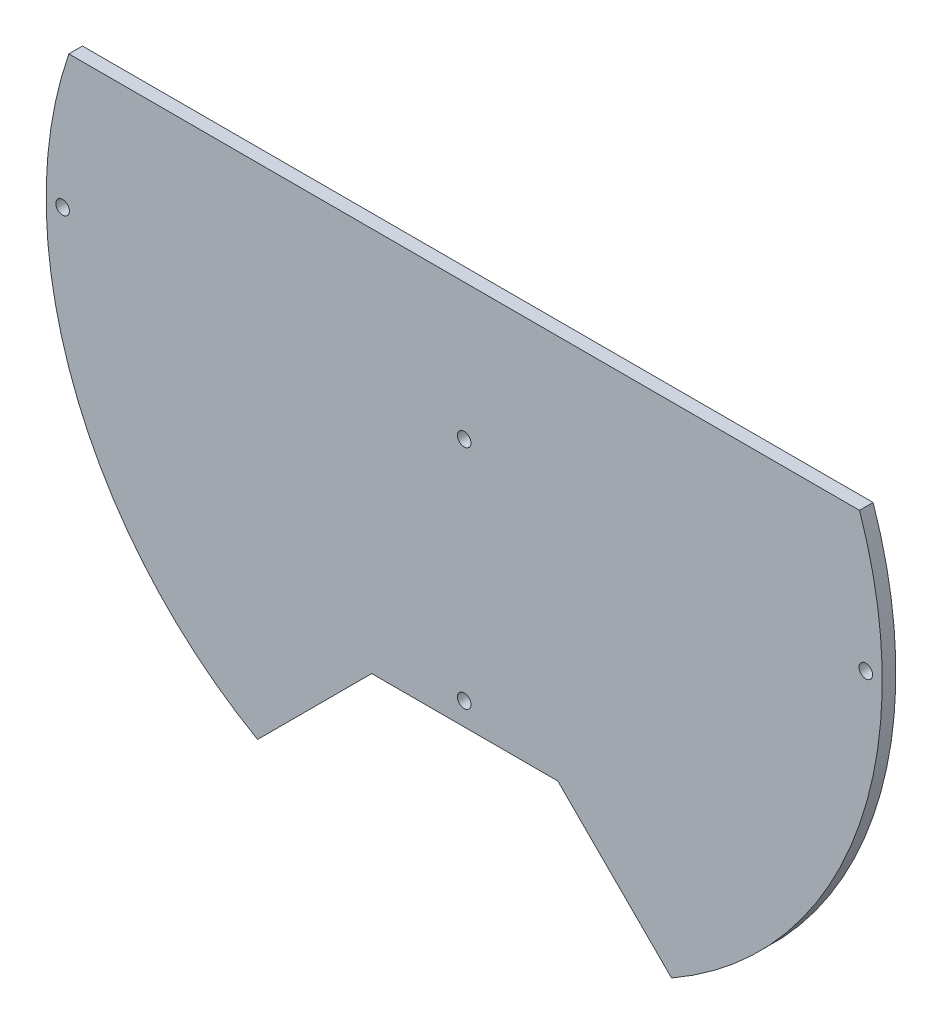
from build123d import *

# Parameters (mm, degrees)
CROQUIS1_R              = 1.5
SALIENTE_EXTRUIR1_DEPTH = 3


with BuildPart() as part:
    # Croquis1 → Saliente-Extruir1 (new body)
    with BuildSketch(Plane.XY):
        with BuildLine():
            Line((87.218748359, 55.090741804), (-87.218748359, 55.090741804))
            ThreePointArc((-87.218748359, 55.090741804), (-86.279970689, -7.51104838), (-45.585521295, -55.090741804))
            Line((-45.585521295, -55.090741804), (-20.404037688, -29.909258196))
            Line((-20.404037688, -29.909258196), (20.648831544, -29.909258196))
            Line((20.648831544, -29.909258196), (45.741459084, -55.001885736))
            ThreePointArc((45.741459084, -55.001885736), (86.311649564, -7.427087381), (87.218748359, 55.090741804))
        make_face()
        with Locations((0, -24.909258196)):
            Circle(CROQUIS1_R, mode=Mode.SUBTRACT)
        with Locations((88.605744965, 25.090741804)):
            Circle(CROQUIS1_R, mode=Mode.SUBTRACT)
        with Locations((0, 25.090741804)):
            Circle(CROQUIS1_R, mode=Mode.SUBTRACT)
        with Locations((-88.605744965, 25.090741804)):
            Circle(CROQUIS1_R, mode=Mode.SUBTRACT)
    extrude(amount=SALIENTE_EXTRUIR1_DEPTH)


solid = part.part
